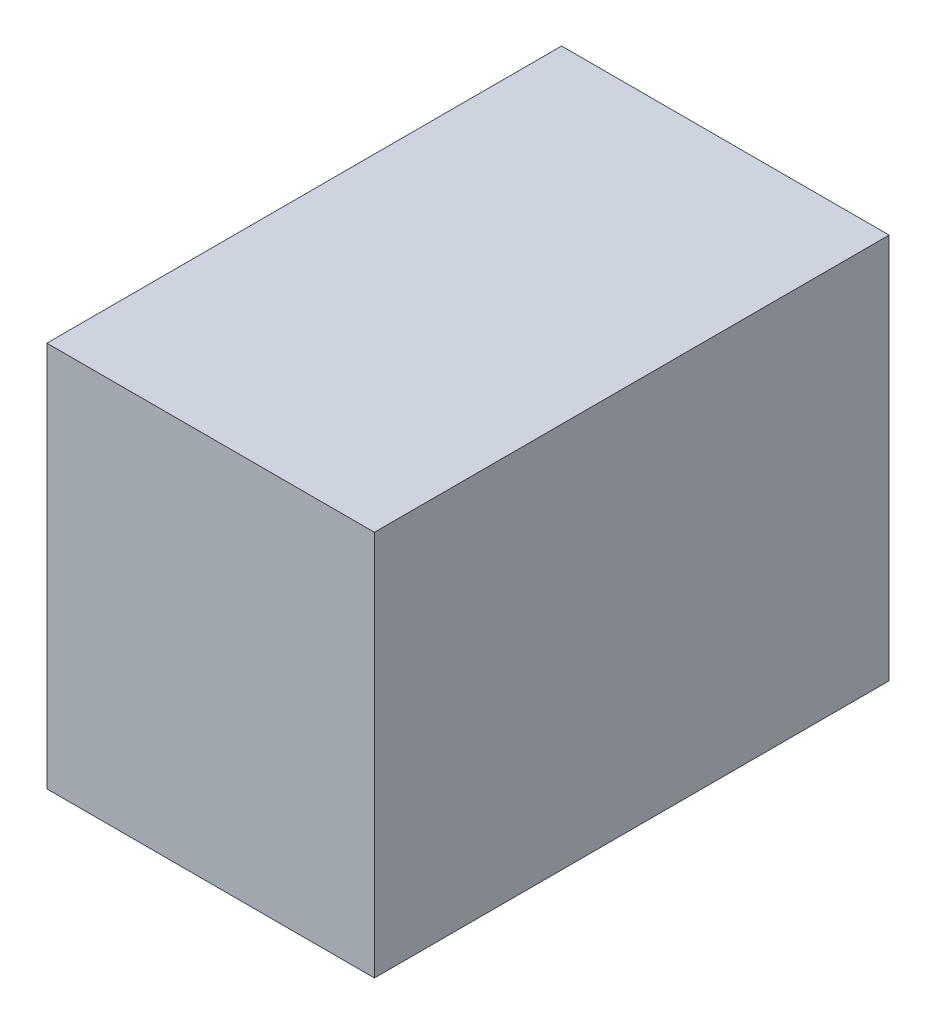
from build123d import *

# Parameters (mm, degrees)
SKETCH1_W           = 140
SKETCH1_H           = 220
BOSS_EXTRUDE1_DEPTH = 165
SHELL1_T            = -2


with BuildPart() as part:
    # Sketch1 → Boss-Extrude1 (new body)
    with BuildSketch(Plane(origin=(0, 0, 0), x_dir=(1, 0, 0), z_dir=(0, 1, 0))):
        Rectangle(SKETCH1_W, SKETCH1_H)
    extrude(amount=BOSS_EXTRUDE1_DEPTH)

    # Shell1
    shell1_openings = [part.faces().sort_by_distance(p)[0] for p in [
        (0, 0, 0),
    ]]
    offset(amount=SHELL1_T, openings=shell1_openings, kind=Kind.INTERSECTION)


solid = part.part
